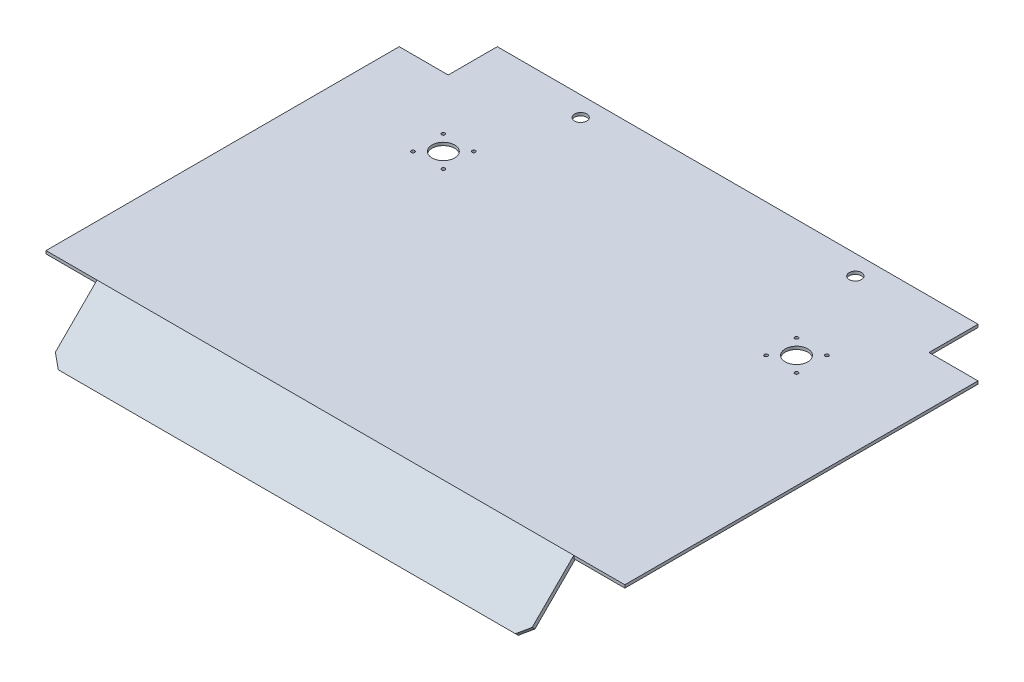
from build123d import *

# Parameters (mm, degrees)
SKETCH1_R           = 11.5
SKETCH1_R_2         = 1.75
SKETCH1_R_3         = 6.25
BOSS_EXTRUDE1_DEPTH = 3
SKETCH2_W           = 486
SKETCH2_H           = 70
BOSS_EXTRUDE2_DEPTH = 4
CHAMFER1_SIZE       = 10


with BuildPart() as part:
    # Sketch1 → Boss-Extrude1 (new body)
    with BuildSketch(Plane(origin=(0, 0, 0), x_dir=(1, 0, 0), z_dir=(0, 1, 0))):
        Polygon((-221.627821886, -114.515571385), (-221.627821886, 245.484428615), (-171.627821886, 245.484428615), (-171.627821886, 295.484428615), (318.372178114, 295.484428615), (318.372178114, 245.484428615), (368.372178114, 245.484428615), (368.372178114, -114.515571385), align=None)
        with Locations(Location((-106.627821886, 175.484428615, 0), (0, 0, 270))):
            Circle(SKETCH1_R, mode=Mode.SUBTRACT)
        with Locations(Location((-122.127821886, 190.984428615, 0), (0, 0, 270))):
            Circle(SKETCH1_R_2, mode=Mode.SUBTRACT)
        with Locations(Location((-91.127821886, 190.984428615, 0), (0, 0, 270))):
            Circle(SKETCH1_R_2, mode=Mode.SUBTRACT)
        with Locations(Location((-91.127821886, 159.984428615, 0), (0, 0, 270))):
            Circle(SKETCH1_R_2, mode=Mode.SUBTRACT)
        with Locations(Location((-122.127821886, 159.984428615, 0), (0, 0, 270))):
            Circle(SKETCH1_R_2, mode=Mode.SUBTRACT)
        with Locations(Location((268.872178114, 159.984428615, 0), (0, 0, 90))):
            Circle(SKETCH1_R_2, mode=Mode.SUBTRACT)
        with Locations(Location((237.872178114, 159.984428615, 0), (0, 0, 90))):
            Circle(SKETCH1_R_2, mode=Mode.SUBTRACT)
        with Locations(Location((237.872178114, 190.984428615, 0), (0, 0, 90))):
            Circle(SKETCH1_R_2, mode=Mode.SUBTRACT)
        with Locations(Location((268.872178114, 190.984428615, 0), (0, 0, 90))):
            Circle(SKETCH1_R_2, mode=Mode.SUBTRACT)
        with Locations(Location((253.372178114, 175.484428615, 0), (0, 0, 90))):
            Circle(SKETCH1_R, mode=Mode.SUBTRACT)
        with Locations(Location((-66.627821886, 275.484428615, 0), (0, 0, 270))):
            Circle(SKETCH1_R_3, mode=Mode.SUBTRACT)
        with Locations(Location((213.372178114, 275.484428615, 0), (0, 0, 270))):
            Circle(SKETCH1_R_3, mode=Mode.SUBTRACT)
    extrude(amount=BOSS_EXTRUDE1_DEPTH)

    # Sketch2 → Boss-Extrude2 (add)
    with BuildSketch(Plane(origin=(0, 58.757785693, 58.757785693), x_dir=(1, 0, 0), z_dir=(0, 0.7071067811865464, 0.7071067811865488))):
        with Locations((73.372178114, -113.853416735)):
            Rectangle(SKETCH2_W, SKETCH2_H)
    extrude(amount=-BOSS_EXTRUDE2_DEPTH)

    # Chamfer1
    chamfer1_edges = [part.edges().sort_by_distance(p)[0] for p in [
        (-169.627821886, -47.911688245, 162.598832506),
        (316.372178114, -47.911688245, 162.598832506),
    ]]
    chamfer(chamfer1_edges, length=CHAMFER1_SIZE)


solid = part.part
